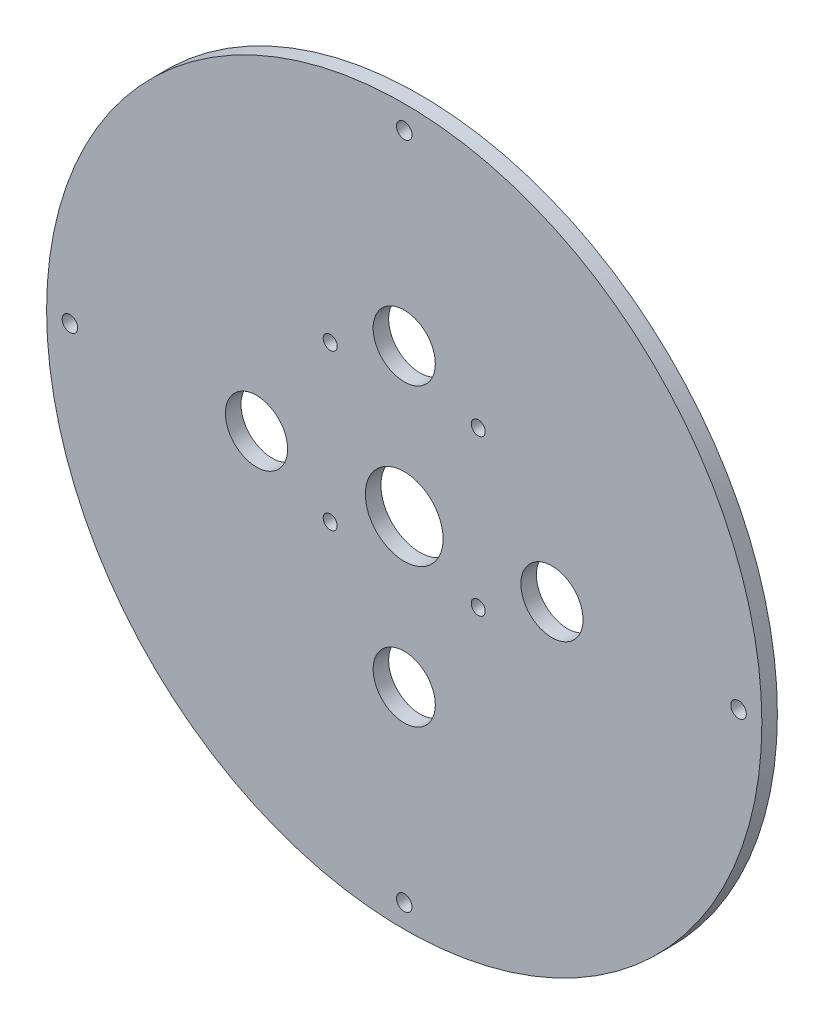
from build123d import *

# Parameters (mm, degrees)
SKETCH1_R           = 146.05
SKETCH1_R_2         = 3.175
SKETCH1_R_3         = 2.8575
SKETCH1_R_4         = 15.875
SKETCH1_R_5         = 12.7
BOSS_EXTRUDE1_DEPTH = 6.35


with BuildPart() as part:
    # Sketch1 → Boss-Extrude1 (new body)
    with BuildSketch(Plane.XY):
        Circle(SKETCH1_R)
        with Locations((0, 136.525)):
            Circle(SKETCH1_R_2, mode=Mode.SUBTRACT)
        with Locations((136.525, 0)):
            Circle(SKETCH1_R_2, mode=Mode.SUBTRACT)
        with Locations((0, -136.525)):
            Circle(SKETCH1_R_2, mode=Mode.SUBTRACT)
        with Locations((-136.525, 0)):
            Circle(SKETCH1_R_2, mode=Mode.SUBTRACT)
        with Locations((-30.226, 46.482)):
            Circle(SKETCH1_R_3, mode=Mode.SUBTRACT)
        with Locations(Location((30.226, 46.482, 0), (0, 0, 180))):
            Circle(SKETCH1_R_3, mode=Mode.SUBTRACT)
        with Locations((30.226, -17.018)):
            Circle(SKETCH1_R_3, mode=Mode.SUBTRACT)
        with Locations(Location((-30.226, -17.018, 0), (0, 0, 180))):
            Circle(SKETCH1_R_3, mode=Mode.SUBTRACT)
        Circle(SKETCH1_R_4, mode=Mode.SUBTRACT)
        with Locations((0, 60.325)):
            Circle(SKETCH1_R_5, mode=Mode.SUBTRACT)
        with Locations((60.325, 0)):
            Circle(SKETCH1_R_5, mode=Mode.SUBTRACT)
        with Locations((0, -60.325)):
            Circle(SKETCH1_R_5, mode=Mode.SUBTRACT)
        with Locations((-60.325, 0)):
            Circle(SKETCH1_R_5, mode=Mode.SUBTRACT)
    extrude(amount=BOSS_EXTRUDE1_DEPTH)


solid = part.part
